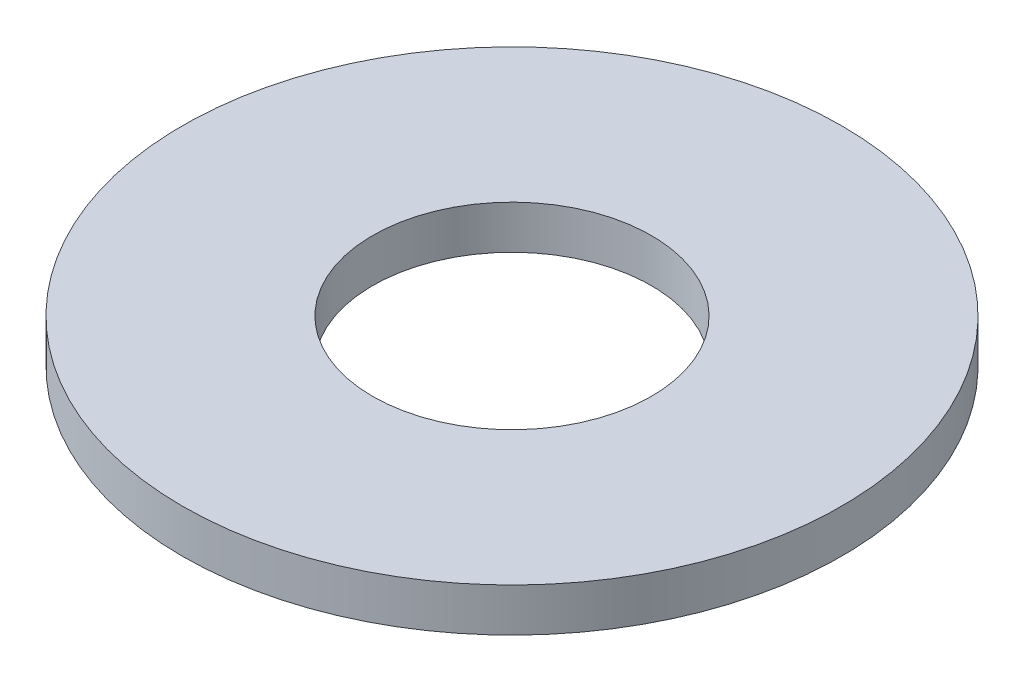
from build123d import *

# Parameters (mm, degrees)
SKETCH1_R           = 37.95
SKETCH1_R_2         = 16.05
BOSS_EXTRUDE1_DEPTH = 5


with BuildPart() as part:
    # Sketch1 → Boss-Extrude1 (new body)
    with BuildSketch(Plane(origin=(0, 0, 0), x_dir=(1, 0, 0), z_dir=(0, 1, 0))):
        with Locations(Location((0, 0, 0), (0, 0, 270))):
            Circle(SKETCH1_R)
        with Locations(Location((0, 0, 0), (0, 0, 270))):
            Circle(SKETCH1_R_2, mode=Mode.SUBTRACT)
    extrude(amount=BOSS_EXTRUDE1_DEPTH)


solid = part.part
